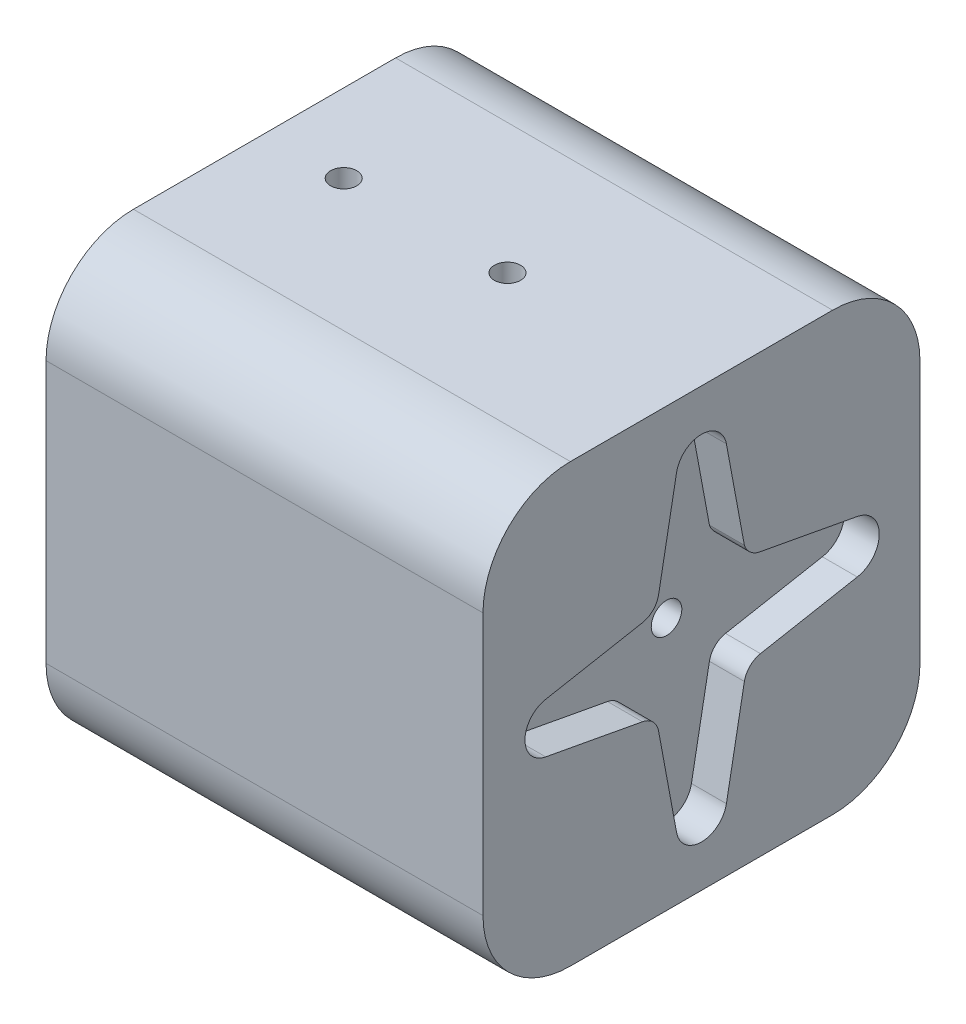
from build123d import *

# Parameters (mm, degrees)
ESQUISSE1_W             = 50
ESQUISSE1_H             = 50
BOSS_EXTRU_1_DEPTH      = 50
ESQUISSE2_R             = 6
ENL_V_MAT_EXTRU_1_DEPTH = 40
CONG_1_R                = 10
ESQUISSE3_R             = 1.5
ENL_V_MAT_EXTRU_2_DEPTH = 21
ENL_V_MAT_EXTRU_3_DEPTH = 4
ESQUISSE5_R             = 1.75
ENL_V_MAT_EXTRU_4_DEPTH = 90


with BuildPart() as part:
    # Esquisse1 → Boss.-Extru.1 (new body)
    with BuildSketch(Plane.XY):
        with Locations((25, 25)):
            Rectangle(ESQUISSE1_W, ESQUISSE1_H)
    extrude(amount=BOSS_EXTRU_1_DEPTH)

    # Esquisse2 → Enlèv. mat.-Extru.1 (cut)
    with BuildSketch(Plane.ZY):
        with Locations((24.976890997, 24.856256207)):
            Circle(ESQUISSE2_R)
    extrude(amount=-ENL_V_MAT_EXTRU_1_DEPTH, mode=Mode.SUBTRACT)

    # Congé1
    cong_1_edges = [part.edges().sort_by_distance(p)[0] for p in [
        (25, 50, 50),
        (25, 50, 0),
        (25, 0, 0),
        (25, 0, 50),
    ]]
    fillet(cong_1_edges, radius=CONG_1_R)

    # Esquisse3 → Enlèv. mat.-Extru.2 (cut)
    with BuildSketch(Plane(origin=(0, 50, 0), x_dir=(1, 0, 0), z_dir=(0, 1, 0))):
        with Locations(Location((8.958242403, -24.894645172, 0), (0, 0, 270))):
            Circle(ESQUISSE3_R)
        with Locations(Location((27.695396355, -24.894645172, 0), (0, 0, 270))):
            Circle(ESQUISSE3_R)
    extrude(amount=-ENL_V_MAT_EXTRU_2_DEPTH, mode=Mode.SUBTRACT)

    # Esquisse4 → Enlèv. mat.-Extru.3 (cut)
    with BuildSketch(Plane(origin=(50, 0, 0), x_dir=(0, 0, -1), z_dir=(1, 0, 0))):
        with BuildLine():
            Line((-7.144655121, 28.135805281), (-18.224176514, 30.192846764))
            ThreePointArc((-18.224176514, 30.192846764), (-19.380476075, 30.704407729), (-20.091653936, 31.749849906))
            Line((-20.091653936, 31.749849906), (-22.148695418, 42.829371299))
            ThreePointArc((-22.148695418, 42.829371299), (-24.9999654, 45.1999956), (-27.851235382, 42.829371299))
            Line((-27.851235382, 42.829371299), (-29.908276864, 31.749849906))
            ThreePointArc((-29.908276864, 31.749849906), (-30.543285097, 30.543354297), (-31.749780706, 29.908346064))
            Line((-31.749780706, 29.908346064), (-42.829302099, 27.851304582))
            ThreePointArc((-42.829302099, 27.851304582), (-45.1999264, 25.0000346), (-42.829302099, 22.148764618))
            Line((-42.829302099, 22.148764618), (-31.749780706, 20.091723136))
            ThreePointArc((-31.749780706, 20.091723136), (-30.543285097, 19.456714903), (-29.908276864, 18.250219294))
            Line((-29.908276864, 18.250219294), (-27.851235382, 7.170697901))
            ThreePointArc((-27.851235382, 7.170697901), (-24.9999654, 4.8000736), (-22.148695418, 7.170697901))
            Line((-22.148695418, 7.170697901), (-20.091653936, 18.250219294))
            ThreePointArc((-20.091653936, 18.250219294), (-19.456645703, 19.456714903), (-18.250150094, 20.091723136))
            Line((-18.250150094, 20.091723136), (-7.170628701, 22.148764618))
            ThreePointArc((-7.170628701, 22.148764618), (-4.657744871, 25.131439646), (-7.144655121, 28.135805281))
        make_face()
    extrude(amount=-ENL_V_MAT_EXTRU_3_DEPTH, mode=Mode.SUBTRACT)

    # Esquisse5 → Enlèv. mat.-Extru.4 (cut)
    with BuildSketch(Plane(origin=(46, 0, 0), x_dir=(0, 0, -1), z_dir=(1, 0, 0))):
        with Locations(Location((-24.9999654, 25.0000346, 0), (0, 0, 90))):
            Circle(ESQUISSE5_R)
    extrude(amount=-ENL_V_MAT_EXTRU_4_DEPTH, mode=Mode.SUBTRACT)


solid = part.part
